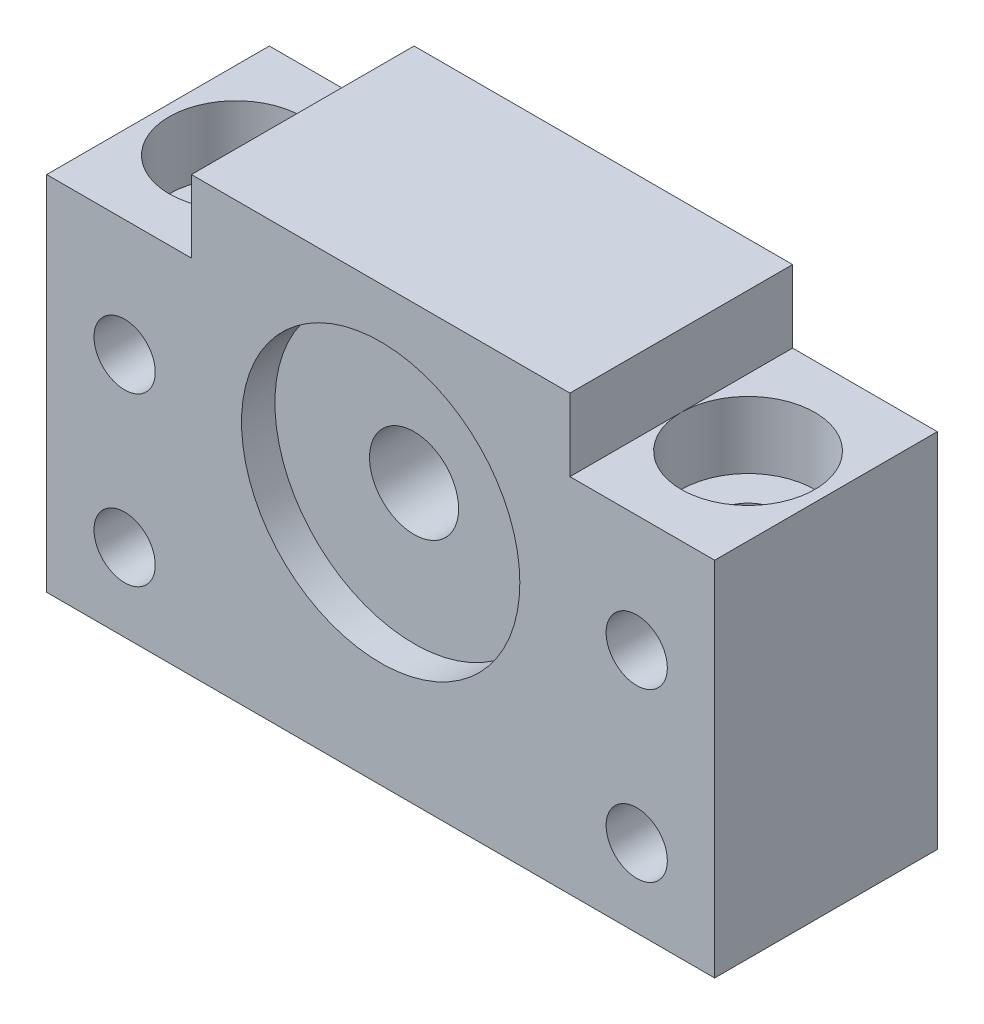
from build123d import *

# Parameters (mm, degrees)
EXTRUDE_1_DEPTH     = 20
SKETCH_2_R          = 2.75
SKETCH_2_R_2        = 4
CUT_EXTRUDE_1_DEPTH = 75.303431953
SKETCH_3_R          = 12.5
CUT_EXTRUDE_2_DEPTH = 3
SKETCH_4_R          = 2.75
CUT_EXTRUDE_3_DEPTH = 72.107313267
SKETCH_5_R          = 6
CUT_EXTRUDE_4_DEPTH = 6


with BuildPart() as part:
    # Эскиз1 → Бобышка-Вытянуть1 (new body)
    with BuildSketch(Plane.XY):
        Polygon((47, 32.5), (60, 32.5), (60, 0), (0, 0), (0, 32.5), (13, 32.5), (13, 39), (47, 39), align=None)
    extrude(amount=EXTRUDE_1_DEPTH)

    # Эскиз2 → Вырез-Вытянуть1 (cut, through all)
    with BuildSketch(Plane.XY.offset(20)):
        with Locations((7, 22)):
            Circle(SKETCH_2_R)
        with Locations((7, 7)):
            Circle(SKETCH_2_R)
        with Locations((53, 22)):
            Circle(SKETCH_2_R)
        with Locations((53, 7)):
            Circle(SKETCH_2_R)
        with Locations((30, 22)):
            Circle(SKETCH_2_R_2)
    extrude(amount=-CUT_EXTRUDE_1_DEPTH, mode=Mode.SUBTRACT)

    # Эскиз3 → Вырез-Вытянуть2 (cut)
    with BuildSketch(Plane.XY.offset(20)):
        with Locations((30, 22)):
            Circle(SKETCH_3_R)
    extrude(amount=-CUT_EXTRUDE_2_DEPTH, mode=Mode.SUBTRACT)

    # Эскиз4 → Вырез-Вытянуть3 (cut, through all)
    with BuildSketch(Plane(origin=(0, 32.5, 0), x_dir=(1, 0, 0), z_dir=(0, 1, 0))):
        with Locations(Location((7, -10, 0), (0, 0, 180))):
            Circle(SKETCH_4_R)
        with Locations(Location((53, -10, 0), (0, 0, 180))):
            Circle(SKETCH_4_R)
    extrude(amount=-CUT_EXTRUDE_3_DEPTH, mode=Mode.SUBTRACT)

    # Эскиз5 → Вырез-Вытянуть4 (cut)
    with BuildSketch(Plane(origin=(0, 32.5, 0), x_dir=(1, 0, 0), z_dir=(0, 1, 0))):
        with Locations(Location((7, -10, 0), (0, 0, 180))):
            Circle(SKETCH_5_R)
        with Locations(Location((53, -10, 0), (0, 0, 180))):
            Circle(SKETCH_5_R)
    extrude(amount=-CUT_EXTRUDE_4_DEPTH, mode=Mode.SUBTRACT)


solid = part.part
